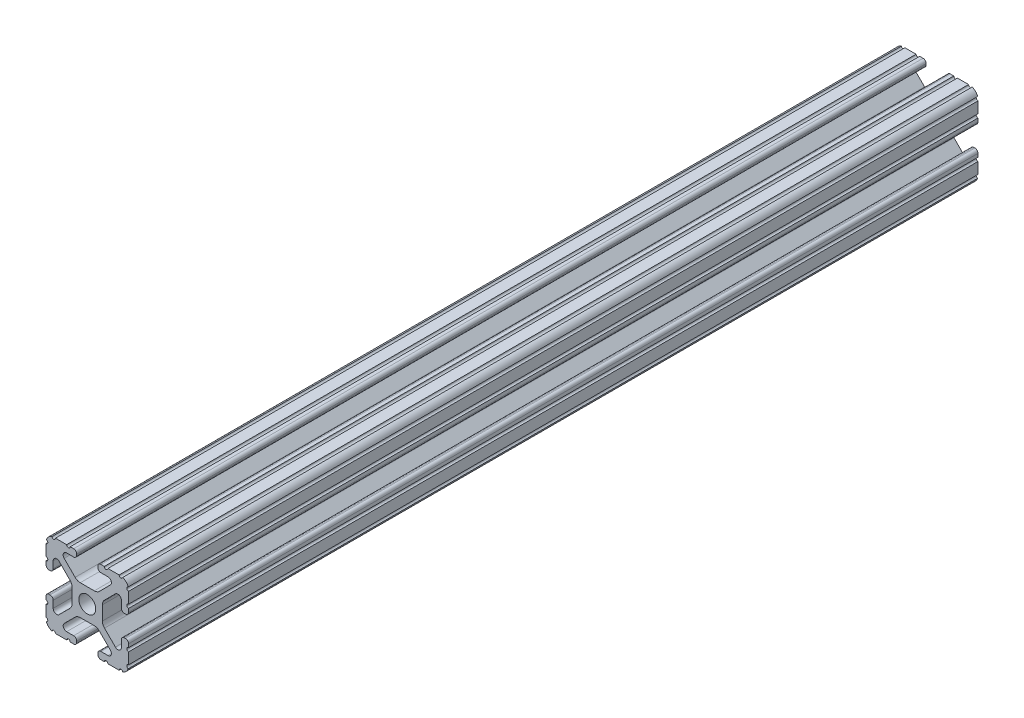
from build123d import *

# Parameters (mm, degrees)
BOSS_EXTRUDE1_START     = -130.688867
BOSS_EXTRUDE1_DEPTH     = 261.377734
CUT_EXTRUDE1_DEPTH      = 132.917246627
CUT_EXTRUDE1_DEPTH_BACK = 132.917246627
SKETCH5_R               = 0.55245


with BuildPart() as part:
    # Sketch4 → Boss-Extrude1 (new body)
    with BuildSketch(Plane.XY.offset(BOSS_EXTRUDE1_START)):
        with BuildLine():
            Line((4.190365, -12.7), (10.11729625, -12.7))
            ThreePointArc((10.11729625, -12.7), (11.943543585, -11.943543585), (12.7, -10.11729625))
            Line((12.7, -10.11729625), (12.7, -4.190365))
            ThreePointArc((12.7, -4.190365), (12.42492494, -3.52627506), (11.760835, -3.2512))
            Line((11.760835, -3.2512), (11.429365, -3.2512))
            ThreePointArc((11.429365, -3.2512), (10.76527506, -3.52627506), (10.4902, -4.190365))
            Line((10.4902, -4.190365), (10.4902, -6.348478019))
            ThreePointArc((10.4902, -6.348478019), (9.830707141, -7.335478831), (8.666460301, -7.103895736))
            Line((8.666460301, -7.103895736), (5.299899128, -3.737334563))
            ThreePointArc((5.299899128, -3.737334563), (4.817571085, -3.015479634), (4.6482, -2.16399369))
            Line((4.6482, -2.16399369), (4.6482, 0))
            Line((4.6482, 0), (2.6035, 0))
            ThreePointArc((2.6035, 0), (1.840952505, -1.840952505), (0, -2.6035))
            Line((0, -2.6035), (0, -4.6482))
            Line((0, -4.6482), (2.16399369, -4.6482))
            ThreePointArc((2.16399369, -4.6482), (3.015479634, -4.817571085), (3.737334563, -5.299899128))
            Line((3.737334563, -5.299899128), (7.103895736, -8.666460301))
            ThreePointArc((7.103895736, -8.666460301), (7.335478831, -9.830707141), (6.348478019, -10.4902))
            Line((6.348478019, -10.4902), (4.190365, -10.4902))
            ThreePointArc((4.190365, -10.4902), (3.52627506, -10.76527506), (3.2512, -11.429365))
            Line((3.2512, -11.429365), (3.2512, -11.760835))
            ThreePointArc((3.2512, -11.760835), (3.52627506, -12.42492494), (4.190365, -12.7))
        make_face()
    extrude(amount=BOSS_EXTRUDE1_DEPTH)

    # Sketch5 → Cut-Extrude1 (cut, two sides: drawn at the far end of the back side and taken through both)
    with BuildSketch(Plane.XY.offset(-CUT_EXTRUDE1_DEPTH_BACK)):
        with Locations((10.356153152, -12.7)):
            Circle(SKETCH5_R)
        with Locations((5.796028019, -12.7)):
            Circle(SKETCH5_R)
        with Locations((12.7, -10.356153152)):
            Circle(SKETCH5_R)
        with Locations((12.7, -5.796028019)):
            Circle(SKETCH5_R)
    extrude(amount=CUT_EXTRUDE1_DEPTH + CUT_EXTRUDE1_DEPTH_BACK, mode=Mode.SUBTRACT)

    # Mirror1: part across plane


with BuildPart() as part_1:
    add(part.part)
    add(part.part.mirror(Plane(origin=(0, 0, 0), x_dir=(0, 0, 1), z_dir=(1, 0, 0))))

    # Mirror2: part across plane


with BuildPart() as part_2:
    add(part_1.part)
    add(part_1.part.mirror(Plane.ZX))


solid = part_2.part
